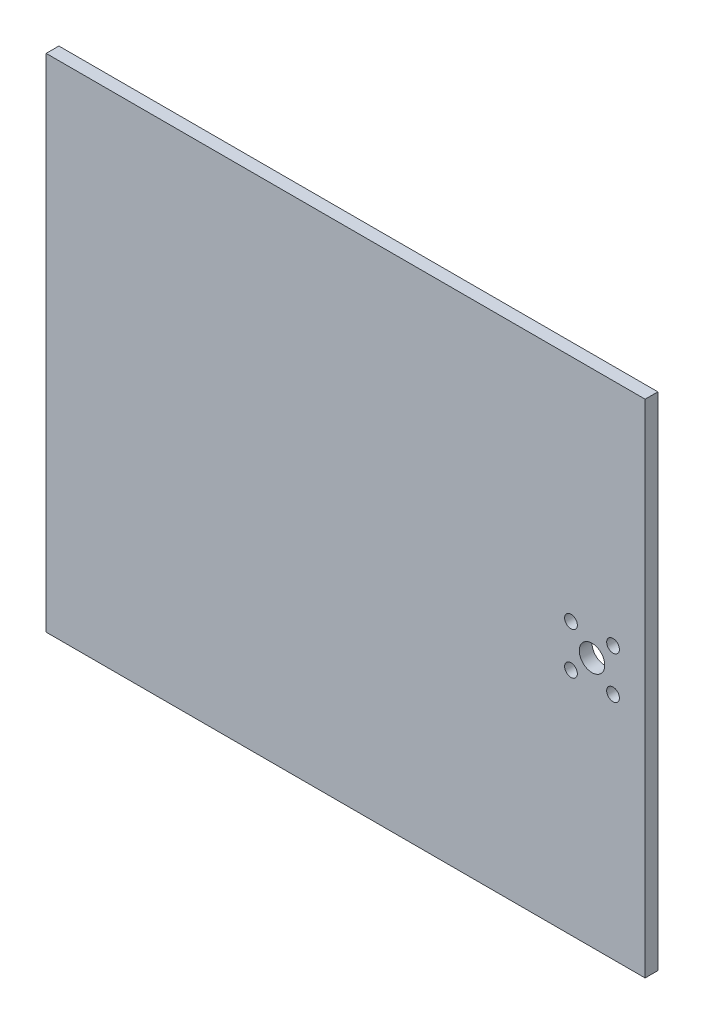
from build123d import *

# Parameters (mm, degrees)
SKETCH_1_W          = 300
SKETCH_1_H          = 118
EXTRUDE_1_DEPTH     = 3
SKETCH_2_R          = 1.5
SKETCH_2_R_2        = 3
CUT_EXTRUDE_1_DEPTH = 3
SKETCH_6_W          = 159
SKETCH_6_H          = 118
CUT_EXTRUDE_2_DEPTH = 10


with BuildPart() as part:
    # 草图1 → 凸台-拉伸1 (new body)
    with BuildSketch(Plane.XY):
        Rectangle(SKETCH_1_W, SKETCH_1_H)
    extrude(amount=EXTRUDE_1_DEPTH)

    # 草图2 → 切除-拉伸1 (cut)
    with BuildSketch(Plane(origin=(0, 0, 0), x_dir=(-1, 0, 0), z_dir=(0, 0, -1))):
        with Locations((-142.449747468, 4.949747468)):
            Circle(SKETCH_2_R)
        with Locations((-132.550252532, 4.949747468)):
            Circle(SKETCH_2_R)
        with Locations((-137.5, 0)):
            Circle(SKETCH_2_R_2)
        with Locations((-142.449747468, -4.949747468)):
            Circle(SKETCH_2_R)
        with Locations((-132.550252532, -4.949747468)):
            Circle(SKETCH_2_R)
    extrude(amount=-CUT_EXTRUDE_1_DEPTH, mode=Mode.SUBTRACT)

    # 草图6 → 切除-拉伸2 (cut)
    with BuildSketch(Plane.XY.offset(3)):
        with Locations((-70.5, 0)):
            Rectangle(SKETCH_6_W, SKETCH_6_H)
    extrude(amount=-CUT_EXTRUDE_2_DEPTH, mode=Mode.SUBTRACT)


solid = part.part
